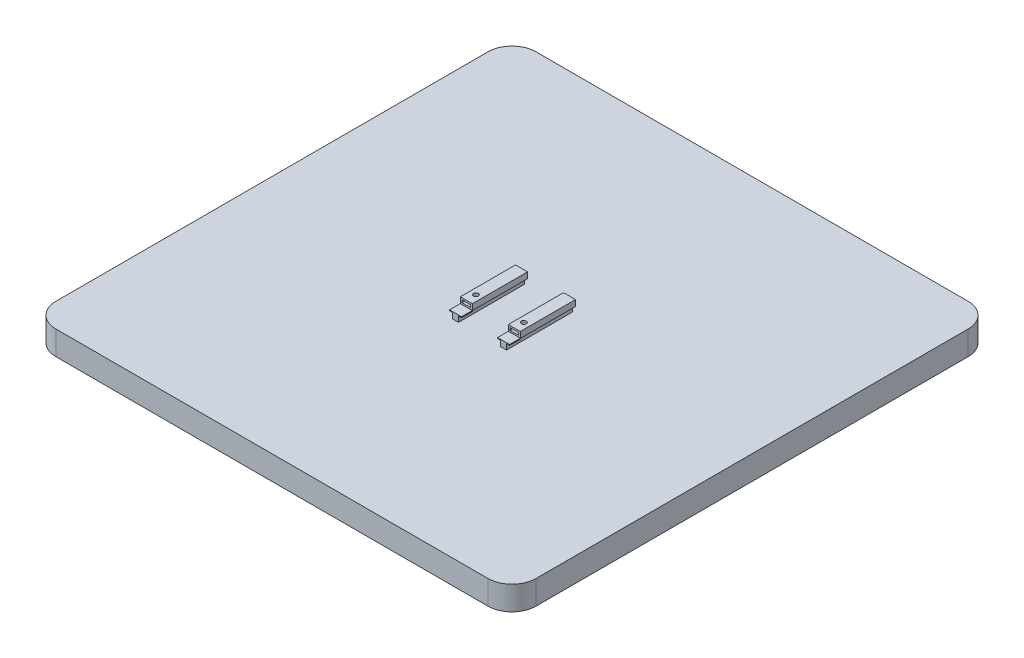
from build123d import *

# Parameters (mm, degrees)
SKETCH1_W                = 200
SKETCH1_H                = 200
BOSS_EXTRUDE1_DEPTH      = 10
SHELL5_T                 = -3
BOSS_EXTRUDE2_DEPTH      = 13.75
SKETCH5_W                = 51.63175717
SKETCH5_H                = 2.8
CUT_EXTRUDE1_DEPTH       = 4.5
SKETCH6_W                = 5
SKETCH6_H                = 4.5
BOSS_EXTRUDE3_DEPTH      = 0.35
SKETCH7_W                = 3.5
SKETCH7_H                = 1
CUT_EXTRUDE2_DEPTH       = 3.5
F_2_0_2_DIAMETER_HOLE2_D = 2
FILLET1_R                = 10


with BuildPart() as part:
    # Sketch1 → Boss-Extrude1 (new body)
    with BuildSketch(Plane(origin=(0, 0, 0), x_dir=(1, 0, 0), z_dir=(0, 1, 0))):
        Rectangle(SKETCH1_W, SKETCH1_H)
    extrude(amount=BOSS_EXTRUDE1_DEPTH)

    # Shell5
    shell5_openings = [part.faces().sort_by_distance(p)[0] for p in [
        (0, 0, 0),
    ]]
    offset(amount=SHELL5_T, openings=shell5_openings, kind=Kind.INTERSECTION)

    # Sketch2 → Boss-Extrude2 (add, symmetric)
    with BuildSketch(Plane.XY):
        Polygon((-11.034760645, 10), (-11.034760645, 12.6), (-12.284760645, 12.6), (-12.284760645, 15.1), (-7.284760645, 15.1), (-7.284760645, 12.6), (-8.534760645, 12.6), (-8.534760645, 10), align=None)
        Polygon((8.965239355, 10), (11.465239355, 10), (11.465239355, 12.6), (12.715239355, 12.6), (12.715239355, 15.1), (7.715239355, 15.1), (7.715239355, 12.6), (8.965239355, 12.6), align=None)
    extrude(amount=BOSS_EXTRUDE2_DEPTH, both=True)

    # Sketch5 → Cut-Extrude1 (cut)
    with BuildSketch(Plane.XY.offset(13.75)):
        with Locations((-9.472877717, 13.7)):
            Rectangle(SKETCH5_W, SKETCH5_H)
        with Locations((17.311892559, -46.179704591)):
            Rectangle(SKETCH5_W, SKETCH5_H)
    extrude(amount=-CUT_EXTRUDE1_DEPTH, mode=Mode.SUBTRACT)

    # Sketch6 → Boss-Extrude3 (add)
    with BuildSketch(Plane(origin=(0, 12.3, 0), x_dir=(1, 0, 0), z_dir=(0, 1, 0))):
        with Locations((10.215239355, -11.5)):
            Rectangle(SKETCH6_W, SKETCH6_H)
        with Locations((-9.784760645, -11.5)):
            Rectangle(SKETCH6_W, SKETCH6_H)
    extrude(amount=BOSS_EXTRUDE3_DEPTH)

    # Sketch7 → Cut-Extrude2 (cut)
    with BuildSketch(Plane.XY.offset(9.25)):
        with Locations((10.215239355, 13.85)):
            Rectangle(SKETCH7_W, SKETCH7_H)
        with Locations((-9.784760645, 13.85)):
            Rectangle(SKETCH7_W, SKETCH7_H)
    extrude(amount=-CUT_EXTRUDE2_DEPTH, mode=Mode.SUBTRACT)

    # Ø2.0 (2) Diameter Hole2 (through all)
    with Locations(Plane(origin=(0, 15.1, 0), x_dir=(1, 0, 0), z_dir=(0, 1, 0))):
        with Locations((-9.784760645, -5.25), (10.215239355, -5.25)):
            Hole(F_2_0_2_DIAMETER_HOLE2_D / 2)

    # Fillet1
    fillet1_edges = [part.edges().sort_by_distance(p)[0] for p in [
        (-100, 5, -100),
        (100, 5, -100),
        (100, 5, 100),
        (-100, 5, 100),
    ]]
    fillet(fillet1_edges, radius=FILLET1_R)


solid = part.part
